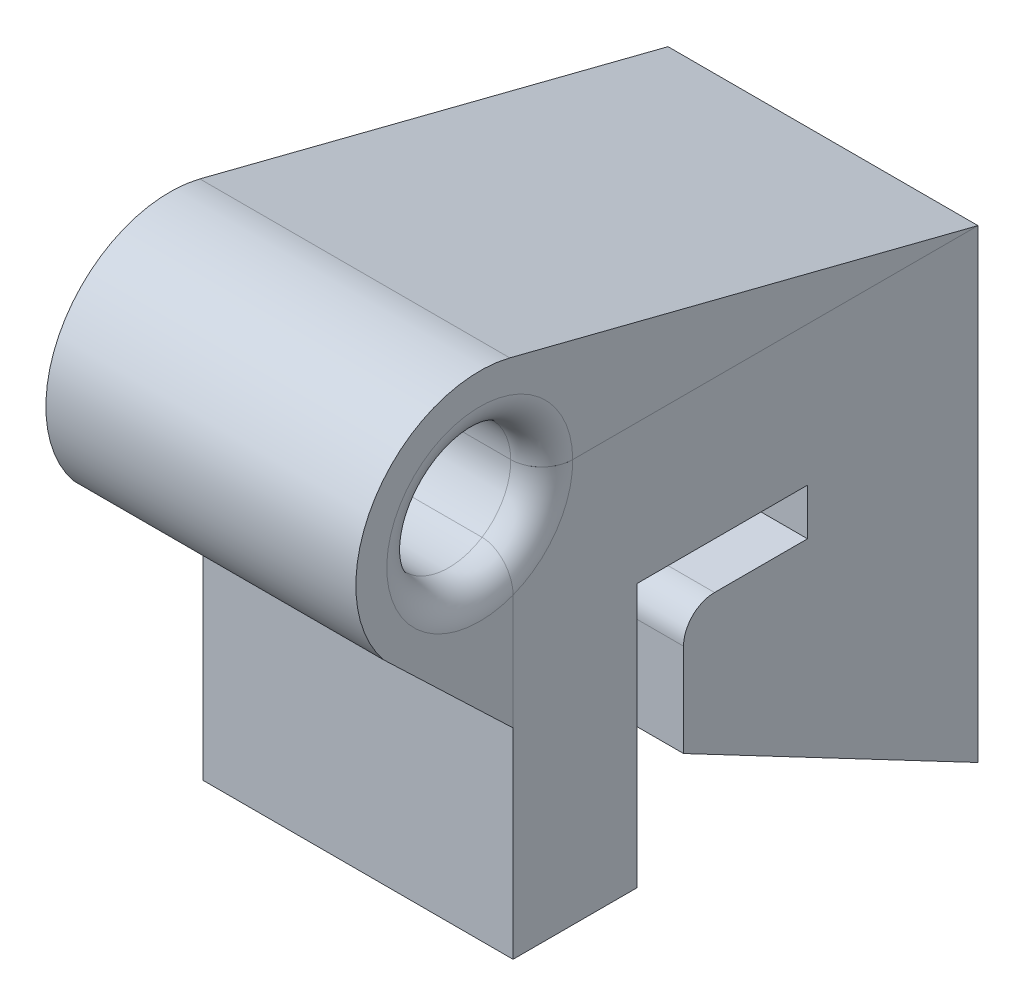
from build123d import *

# Parameters (mm, degrees)
BOSS_EXTRU_5_DEPTH      = 10
CONG_1_R                = 1
BOSS_EXTRU_6_DEPTH      = 10
ESQUISSE8_R             = 2
ENL_V_MAT_EXTRU_1_DEPTH = 27.423794497
CONG_3_R                = 1
CONG_4_R                = 1
CONG_5_R                = 1
CONG_6_R                = 1


with BuildPart() as part:
    # Esquisse5 → Boss.-Extru.5 (new body)
    with BuildSketch(Plane(origin=(0, 0, 0), x_dir=(0, 0, -1), z_dir=(1, 0, 0))):
        Polygon((0, -5), (0, 10), (-15, 10), (-15, -3), (-11, -3), (-11, 5.5), (-5.5, 5.5), (-5.5, 4), (-9.5, 4), (-9.5, 0), align=None)
    extrude(amount=BOSS_EXTRU_5_DEPTH)

    # Congé1
    cong_1_edges = [part.edges().sort_by_distance(p)[0] for p in [
        (5, 4, 9.5),
    ]]
    fillet(cong_1_edges, radius=CONG_1_R)


with BuildPart() as body_2:
    # Esquisse7 → Boss.-Extru.6 (new body)
    with BuildSketch(Plane.ZY):
        with BuildLine():
            Line((0, 10), (15.104430089, 13.85720698))
            ThreePointArc((15.104430089, 13.85720698), (19.449639193, 12.120509449), (19.169719572, 7.449470434))
            Line((19.169719572, 7.449470434), (15, 3.466574051))
            Line((15, 3.466574051), (15, 10))
            Line((15, 10), (0, 10))
        make_face()
    extrude(amount=-BOSS_EXTRU_6_DEPTH)


with BuildPart() as enl_v_mat_extru_1_tool:
    # Esquisse8 → Enlèv. mat.-Extru.1 (new, through all)
    with BuildSketch(Plane(origin=(10, 0, 0), x_dir=(0, 0, -1), z_dir=(1, 0, 0))):
        with Locations((-16.074008639, 9.978892781)):
            Circle(ESQUISSE8_R)
    extrude(amount=-ENL_V_MAT_EXTRU_1_DEPTH)


with BuildPart() as part_1:
    add(part.part)

    # Enlèv. mat.-Extru.1: cut by enl_v_mat_extru_1_tool
    add(enl_v_mat_extru_1_tool.part, mode=Mode.SUBTRACT)

    # Congé5
    cong_5_edges = [part_1.edges().sort_by_distance(p)[0] for p in [
        (10, 9.025873602, 14.315670093),
    ]]
    fillet(cong_5_edges, radius=CONG_5_R)

    # Congé6
    cong_6_edges = [part_1.edges().sort_by_distance(p)[0] for p in [
        (0, 9.025873602, 14.315670093),
    ]]
    fillet(cong_6_edges, radius=CONG_6_R)


with BuildPart() as body_2_1:
    add(body_2.part)

    # Enlèv. mat.-Extru.1: cut by enl_v_mat_extru_1_tool
    add(enl_v_mat_extru_1_tool.part, mode=Mode.SUBTRACT)

    # Congé3
    cong_3_edges = [body_2_1.edges().sort_by_distance(p)[0] for p in [
        (0, 10.931911961, 17.832347185),
    ]]
    fillet(cong_3_edges, radius=CONG_3_R)

    # Congé4
    cong_4_edges = [body_2_1.edges().sort_by_distance(p)[0] for p in [
        (10, 10.931911961, 17.832347185),
    ]]
    fillet(cong_4_edges, radius=CONG_4_R)


solid = Compound([part_1.part, body_2_1.part])
